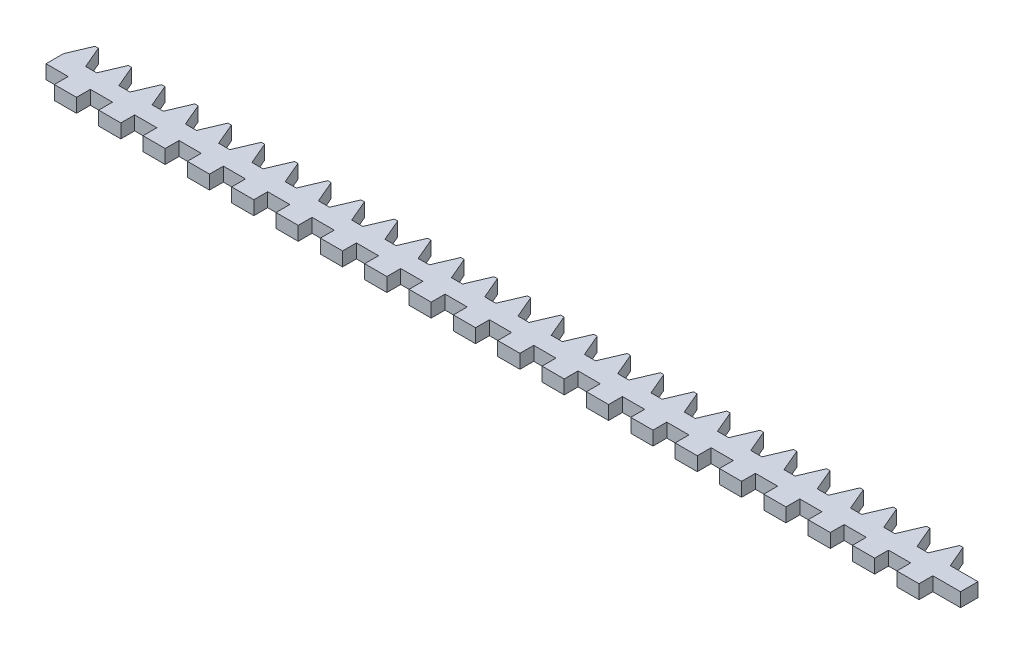
from build123d import *

# Parameters (mm, degrees)
BOSS_EXTRUDE1_DEPTH = 3.175


with BuildPart() as part:
    # Sketch1 → Boss-Extrude1 (new body)
    with BuildSketch(Plane(origin=(0, 0, 0), x_dir=(1, 0, 0), z_dir=(0, 1, 0))):
        Polygon((-139.430495518, 6.053301935), (-139.430495518, 2.053301935), (-134.350495518, 2.053301935), (-134.350495518, -1.121698065), (-129.270495518, -1.121698065), (-129.270495518, 2.053301935), (-124.190495518, 2.053301935), (-124.190495518, -1.121698065), (-119.110495518, -1.121698065), (-119.110495518, 2.053301935), (-114.030495518, 2.053301935), (-114.030495518, -1.121698065), (-108.950495518, -1.121698065), (-108.950495518, 2.053301935), (-103.870495518, 2.053301935), (-103.870495518, -1.121698065), (-98.790495518, -1.121698065), (-98.790495518, 2.053301935), (-93.710495518, 2.053301935), (-93.710495518, -1.121698065), (-88.630495518, -1.121698065), (-88.630495518, 2.053301935), (-83.550495518, 2.053301935), (-83.550495518, -1.121698065), (-78.470495518, -1.121698065), (-78.470495518, 2.053301935), (-73.390495518, 2.053301935), (-73.390495518, -1.121698065), (-68.310495518, -1.121698065), (-68.310495518, 2.053301935), (-63.230495518, 2.053301935), (-63.230495518, -1.121698065), (-58.150495518, -1.121698065), (-58.150495518, 2.053301935), (-53.070495518, 2.053301935), (-53.070495518, -1.121698065), (-47.990495518, -1.121698065), (-47.990495518, 2.053301935), (-42.910495518, 2.053301935), (-42.910495518, -1.121698065), (-37.830495518, -1.121698065), (-37.830495518, 2.053301935), (-32.750495518, 2.053301935), (-32.750495518, -1.121698065), (-27.670495518, -1.121698065), (-27.670495518, 2.053301935), (-22.590495518, 2.053301935), (-22.590495518, -1.121698065), (-17.510495518, -1.121698065), (-17.510495518, 2.053301935), (-12.430495518, 2.053301935), (-12.430495518, -1.121698065), (-7.350495518, -1.121698065), (-7.350495518, 2.053301935), (-2.270495518, 2.053301935), (-2.270495518, -1.121698065), (2.809504482, -1.121698065), (2.809504482, 2.053301935), (7.889504482, 2.053301935), (7.889504482, -1.121698065), (12.969504482, -1.121698065), (12.969504482, 2.053301935), (18.049504482, 2.053301935), (18.049504482, -1.121698065), (23.129504482, -1.121698065), (23.129504482, 2.053301935), (28.209504482, 2.053301935), (28.209504482, -1.121698065), (33.289504482, -1.121698065), (33.289504482, 2.053301935), (38.369504482, 2.053301935), (38.369504482, -1.121698065), (43.449504482, -1.121698065), (43.449504482, 2.053301935), (48.529504482, 2.053301935), (48.529504482, -1.121698065), (53.609504482, -1.121698065), (53.609504482, 2.053301935), (58.689504482, 2.053301935), (58.689504482, -1.121698065), (63.769504482, -1.121698065), (63.769504482, 2.053301935), (70.119504482, 2.053301935), (70.119504482, 6.053301935), (66.309504482, 6.053301935), (63.769504482, 6.053301935), (61.610504482, 11.133301935), (60.848504482, 11.133301935), (58.689504482, 6.053301935), (56.149504482, 6.053301935), (53.990504482, 11.133301935), (53.228504482, 11.133301935), (51.069504482, 6.053301935), (48.529504482, 6.053301935), (46.370504482, 11.133301935), (45.608504482, 11.133301935), (43.449504482, 6.053301935), (40.909504482, 6.053301935), (38.750504482, 11.133301935), (37.988504482, 11.133301935), (35.829504482, 6.053301935), (33.289504482, 6.053301935), (31.130504482, 11.133301935), (30.368504482, 11.133301935), (28.209504482, 6.053301935), (25.669504482, 6.053301935), (23.510504482, 11.133301935), (22.748504482, 11.133301935), (20.589504482, 6.053301935), (18.049504482, 6.053301935), (15.890504482, 11.133301935), (15.128504482, 11.133301935), (12.969504482, 6.053301935), (10.429504482, 6.053301935), (8.270504482, 11.133301935), (7.508504482, 11.133301935), (5.349504482, 6.053301935), (2.809504482, 6.053301935), (0.650504482, 11.133301935), (-0.111495518, 11.133301935), (-2.270495518, 6.053301935), (-4.810495518, 6.053301935), (-6.969495518, 11.133301935), (-7.731495518, 11.133301935), (-9.890495518, 6.053301935), (-12.430495518, 6.053301935), (-14.589495518, 11.133301935), (-15.351495518, 11.133301935), (-17.510495518, 6.053301935), (-20.050495518, 6.053301935), (-22.209495518, 11.133301935), (-22.971495518, 11.133301935), (-25.130495518, 6.053301935), (-27.670495518, 6.053301935), (-29.829495518, 11.133301935), (-30.591495518, 11.133301935), (-32.750495518, 6.053301935), (-35.290495518, 6.053301935), (-37.449495518, 11.133301935), (-38.211495518, 11.133301935), (-40.370495518, 6.053301935), (-42.910495518, 6.053301935), (-45.069495518, 11.133301935), (-45.831495518, 11.133301935), (-47.990495518, 6.053301935), (-50.530495518, 6.053301935), (-52.689495518, 11.133301935), (-53.451495518, 11.133301935), (-55.610495518, 6.053301935), (-58.150495518, 6.053301935), (-60.309495518, 11.133301935), (-61.071495518, 11.133301935), (-63.230495518, 6.053301935), (-65.770495518, 6.053301935), (-67.929495518, 11.133301935), (-68.691495518, 11.133301935), (-70.850495518, 6.053301935), (-73.390495518, 6.053301935), (-75.549495518, 11.133301935), (-76.311495518, 11.133301935), (-78.470495518, 6.053301935), (-81.010495518, 6.053301935), (-83.169495518, 11.133301935), (-83.931495518, 11.133301935), (-86.090495518, 6.053301935), (-88.630495518, 6.053301935), (-90.789495518, 11.133301935), (-91.551495518, 11.133301935), (-93.710495518, 6.053301935), (-96.250495518, 6.053301935), (-98.409495518, 11.133301935), (-99.171495518, 11.133301935), (-101.330495518, 6.053301935), (-103.870495518, 6.053301935), (-106.029495518, 11.133301935), (-106.791495518, 11.133301935), (-108.950495518, 6.053301935), (-111.490495518, 6.053301935), (-113.649495518, 11.133301935), (-114.411495518, 11.133301935), (-116.570495518, 6.053301935), (-119.110495518, 6.053301935), (-121.269495518, 11.133301935), (-122.031495518, 11.133301935), (-124.190495518, 6.053301935), (-126.730495518, 6.053301935), (-128.889495518, 11.133301935), (-129.651495518, 11.133301935), (-131.810495518, 6.053301935), (-134.350495518, 6.053301935), (-136.509495518, 11.133301935), (-137.271495518, 11.133301935), align=None)
    extrude(amount=BOSS_EXTRUDE1_DEPTH)


solid = part.part
